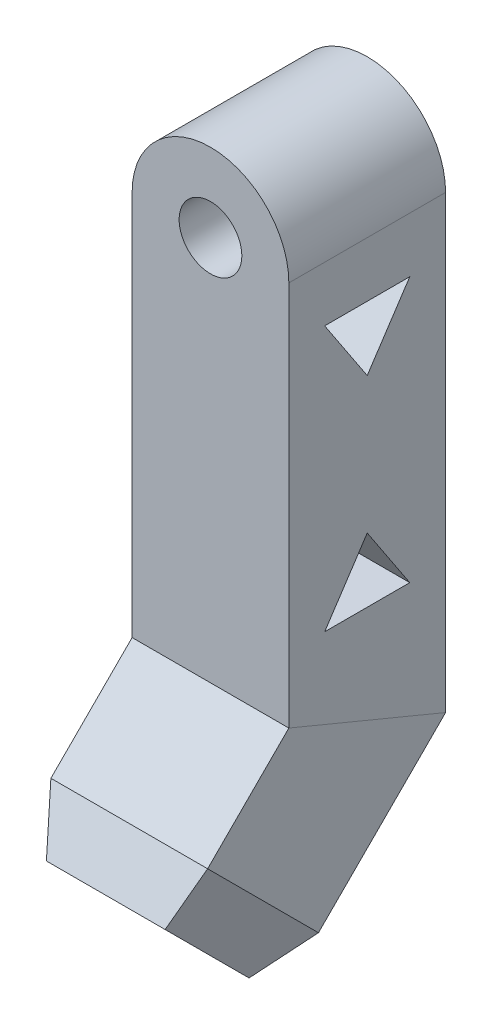
from build123d import *

# Parameters (mm, degrees)
SKETCH11_W          = 38.1
SKETCH11_H          = 38.1
SKETCH12_W          = 38.1
SKETCH12_H          = 38.1
BOSS_EXTRUDE5_DEPTH = 12.7
BOSS_EXTRUDE5_TAPER = 20
BOSS_EXTRUDE6_DEPTH = 38.1
SKETCH14_R          = 7.62
CUT_EXTRUDE2_DEPTH  = 38.1
SKETCH15_R          = 12.065
CUT_EXTRUDE3_DEPTH  = 12.7
CUT_EXTRUDE4_DEPTH  = 38.1


with BuildPart() as part:
    # Sweep1: sweep along a path in Sketch10
    with BuildLine(Plane(origin=(0, 0, 0), x_dir=(0, 0, -1), z_dir=(1, 0, 0))) as sweep1_path:
        Line((0, 96.393), (0, -5.207))
        Line((0, -5.207), (-25.324322261, -30.531322261))
    # Sketch11 → Sweep1 (sweep)
    with BuildSketch(Plane(origin=(0, 96.393, 0), x_dir=(1, 0, 0), z_dir=(0, 1, 0))):
        Rectangle(SKETCH11_W, SKETCH11_H)
    sweep(path=sweep1_path.line, transition=Transition.RIGHT)

    # Sketch12 → Boss-Extrude5 (add)
    with BuildSketch(Plane(origin=(0, -27.927822261, 27.927822261), x_dir=(1, 0, 0), z_dir=(0, -0.7071067811865461, 0.7071067811865489))):
        with Locations((0, -3.68190501)):
            Rectangle(SKETCH12_W, SKETCH12_H)
    extrude(amount=BOSS_EXTRUDE5_DEPTH, taper=BOSS_EXTRUDE5_TAPER)

    # Sketch13 → Boss-Extrude6 (add)
    with BuildSketch(Plane(origin=(0, 0, -19.05), x_dir=(-1, 0, 0), z_dir=(0, 0, -1))):
        with BuildLine():
            Line((-19.05, 96.393), (19.05, 96.393))
            ThreePointArc((19.05, 96.393), (0, 115.443), (-19.05, 96.393))
        make_face()
    extrude(amount=-BOSS_EXTRUDE6_DEPTH)

    # Sketch14 → Cut-Extrude2 (cut)
    with BuildSketch(Plane.XY.offset(19.05)):
        with Locations((0, 96.393)):
            Circle(SKETCH14_R)
    extrude(amount=-CUT_EXTRUDE2_DEPTH, mode=Mode.SUBTRACT)

    # Sketch15 → Cut-Extrude3 (cut)
    with BuildSketch(Plane(origin=(0, -36.908078382, 36.908078382), x_dir=(1, 0, 0), z_dir=(0, -0.7071067811865461, 0.7071067811865489))):
        with Locations(Location((0, -3.68190501, 0), (0, 0, 270))):
            Circle(SKETCH15_R)
    extrude(amount=-CUT_EXTRUDE3_DEPTH, mode=Mode.SUBTRACT)

    # Sketch16 → Cut-Extrude4 (cut)
    with BuildSketch(Plane.ZY.offset(19.05)):
        Polygon((-10.345169525, 82.99999799), (10.345169525, 82.99999799), (0, 67.376680748), align=None)
        Polygon((10.345169525, 18.60000201), (0, 34.223319252), (-10.345169525, 18.60000201), align=None)
    extrude(amount=-CUT_EXTRUDE4_DEPTH, mode=Mode.SUBTRACT)


solid = part.part
